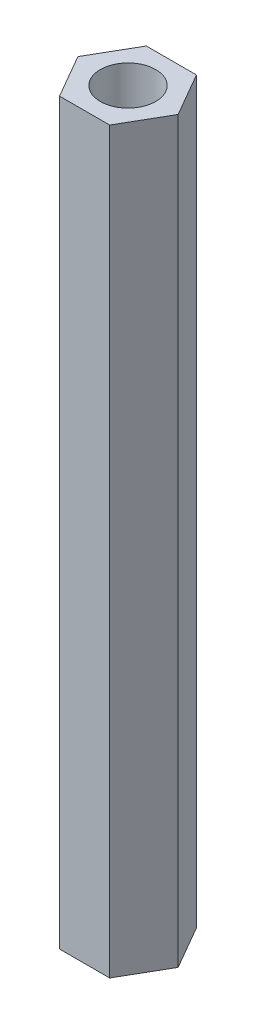
from build123d import *

# Parameters (mm, degrees)
SKETCH_1_R      = 1.5
EXTRUDE_1_DEPTH = 40


with BuildPart() as part:
    # 草图1 → 凸台-拉伸1 (new body)
    with BuildSketch(Plane(origin=(0, 0, 0), x_dir=(1, 0, 0), z_dir=(0, 1, 0))):
        Polygon((2.713546265, 0), (1.356773133, 2.35), (-1.356773133, 2.35), (-2.713546265, 0), (-1.356773133, -2.35), (1.356773133, -2.35), align=None)
        with Locations(Location((0, 0, 0), (0, 0, 270))):
            Circle(SKETCH_1_R, mode=Mode.SUBTRACT)
    extrude(amount=EXTRUDE_1_DEPTH)


solid = part.part
